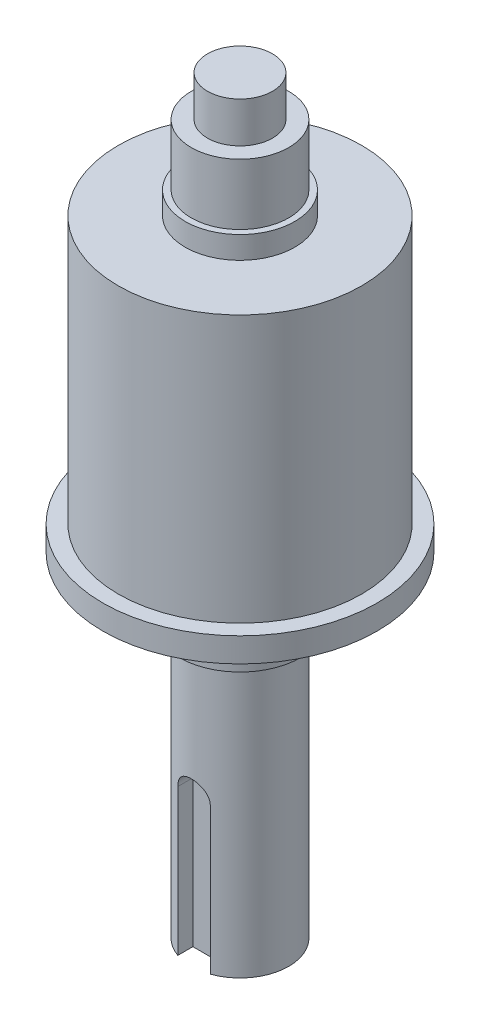
from build123d import *

# Parameters (mm, degrees)
CUT_EXTRUDE1_DEPTH = 15
CUT_EXTRUDE2_DEPTH = 97.068885231


with BuildPart() as part:
    # Sketch2 → Revolve1 (revolve)
    with BuildSketch(Plane.XY, mode=Mode.PRIVATE) as revolve1_sk:
        Polygon((0, 0), (-4, 0), (-4, -5), (-6, -5), (-6, -12.5), (-6.75, -12.5), (-6.75, -15.25), (-14.9815, -15.25), (-14.9815, -48.11), (-16.8815, -48.11), (-16.8815, -51.11), (-8.25, -51.11), (-8.25, -53.61), (-7.5, -53.61), (-7.5, -58.61), (-6, -58.61), (-6, -92.285), (0, -92.285), align=None)
    revolve(revolve1_sk.sketch.rotate(Axis((0, 40.033449689, 0), (0, -1, 0)), 270), axis=Axis((0, 40.033449689, 0), (0, -1, 0)))

    # Sketch3 → Cut-Extrude1 (cut)
    with BuildSketch(Plane.XZ.offset(92.285)):
        with BuildLine():
            Line((-2, 5.656854249), (-2, 3.8))
            Line((-2, 3.8), (2, 3.8))
            Line((2, 3.8), (2, 5.656854249))
            ThreePointArc((2, 5.656854249), (0, 6), (-2, 5.656854249))
        make_face()
    extrude(amount=-CUT_EXTRUDE1_DEPTH, mode=Mode.SUBTRACT)

    # Sketch4 → Cut-Extrude2 (cut, through all)
    with BuildSketch(Plane.XY.offset(3.8)):
        with BuildLine():
            Line((-2, -77.285), (-2, -74.285))
            ThreePointArc((-2, -74.285), (0, -72.285), (2, -74.285))
            Line((2, -74.285), (2, -77.285))
            Line((2, -77.285), (2, -92.285))
            Line((2, -92.285), (-2, -92.285))
            Line((-2, -92.285), (-2, -77.285))
        make_face()
    extrude(amount=CUT_EXTRUDE2_DEPTH, mode=Mode.SUBTRACT)


solid = part.part
